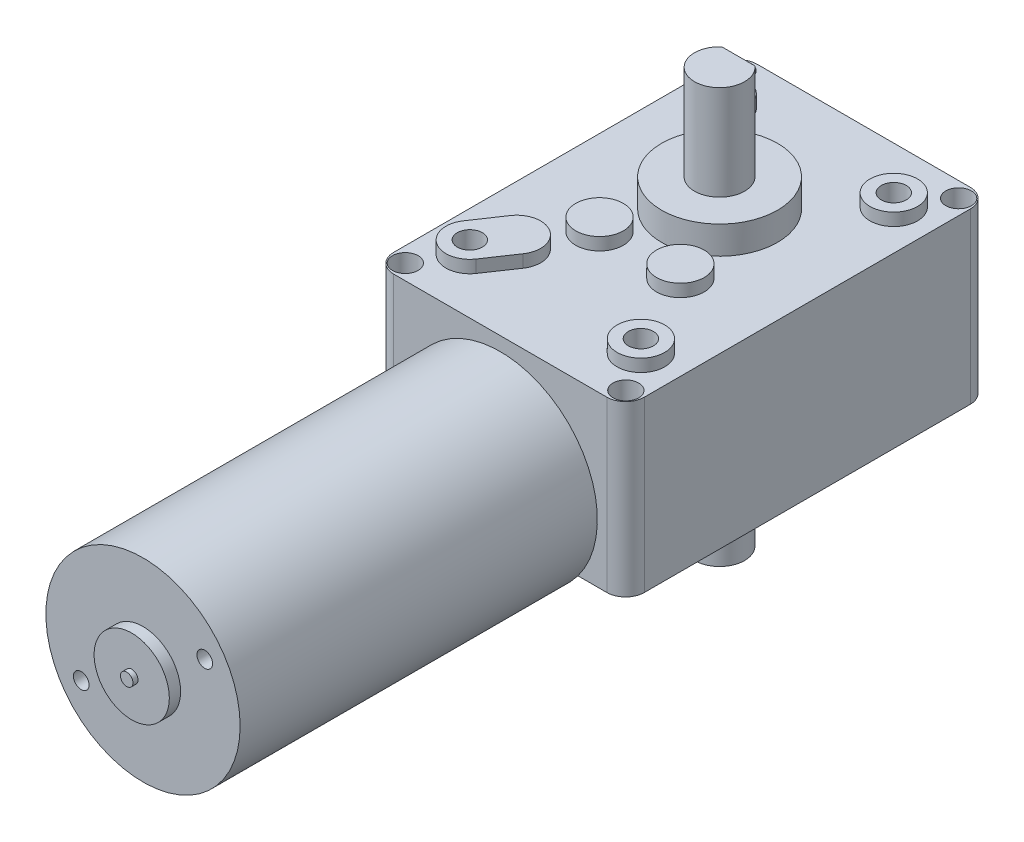
from build123d import *

# Parameters (mm, degrees)
BOSS_EXTRUDE2_DEPTH = 27
SKETCH5_R           = 3.8
BOSS_EXTRUDE3_DEPTH = 2
SKETCH6_R           = 2
CUT_EXTRUDE3_DEPTH  = 4
SKETCH7_R           = 9.25
BOSS_EXTRUDE4_DEPTH = 4.45
SKETCH8_R           = 4
BOSS_EXTRUDE5_DEPTH = 15.14
CUT_EXTRUDE4_START  = -13
CUT_EXTRUDE4_DEPTH  = 13
SKETCH11_R          = 15.5
BOSS_EXTRUDE6_DEPTH = 57
SKETCH12_R          = 6
BOSS_EXTRUDE7_DEPTH = 1.8
SKETCH13_R          = 1
BOSS_EXTRUDE8_DEPTH = 0.8
SKETCH14_R          = 1.25
CUT_EXTRUDE6_DEPTH  = 4
SKETCH10_R          = 2.05
CUT_EXTRUDE5_DEPTH  = 4


with BuildPart() as part:
    # Sketch1 → Boss-Extrude2 (new body)
    with BuildSketch(Plane(origin=(0, 0, 0), x_dir=(1, 0, 0), z_dir=(0, 1, 0))):
        with BuildLine():
            Line((17.005, -29), (-17.005, -29))
            ThreePointArc((-17.005, -29), (-19.126320344, -28.121320344), (-20.005, -26))
            Line((-20.005, -26), (-20.005, 26))
            ThreePointArc((-20.005, 26), (-19.126320344, 28.121320344), (-17.005, 29))
            Line((-17.005, 29), (17.005, 29))
            ThreePointArc((17.005, 29), (19.126320344, 28.121320344), (20.005, 26))
            Line((20.005, 26), (20.005, -26))
            ThreePointArc((20.005, -26), (19.126320344, -28.121320344), (17.005, -29))
        make_face()
    extrude(amount=BOSS_EXTRUDE2_DEPTH)

    # Sketch5 → Boss-Extrude3 (add)
    with BuildSketch(Plane(origin=(0, 27, 0), x_dir=(1, 0, 0), z_dir=(0, 1, 0))):
        with Locations(Location((-13.65, 20.15, 0), (0, 0, 90))):
            Circle(SKETCH5_R)
        with Locations(Location((13.65, 20.15, 0), (0, 0, 90))):
            Circle(SKETCH5_R)
        with Locations(Location((13.65, -20.2, 0), (0, 0, 90))):
            Circle(SKETCH5_R)
        with Locations(Location((-6.45, -6.7, 0), (0, 0, 90))):
            Circle(SKETCH5_R)
        with Locations(Location((6.45, -6.7, 0), (0, 0, 90))):
            Circle(SKETCH5_R)
        with BuildLine():
            Line((-16.798540367, -18.072397227), (-13.775104848, -13.598155653))
            ThreePointArc((-13.775104848, -13.598155653), (-8.498961708, -12.577218059), (-7.478024114, -17.853361199))
            Line((-7.478024114, -17.853361199), (-10.501459633, -22.327602773))
            ThreePointArc((-10.501459633, -22.327602773), (-15.777602773, -23.348540367), (-16.798540367, -18.072397227))
        make_face()
    boss_extrude3 = extrude(amount=BOSS_EXTRUDE3_DEPTH)

    # Sketch6 → Cut-Extrude3 (cut)
    with BuildSketch(Plane(origin=(0, 29, 0), x_dir=(1, 0, 0), z_dir=(0, 1, 0))):
        with Locations(Location((13.65, -20.2, 0), (0, 0, 270))):
            Circle(SKETCH6_R)
        with Locations(Location((13.65, 20.15, 0), (0, 0, 270))):
            Circle(SKETCH6_R)
        with Locations(Location((-13.65, 20.15, 0), (0, 0, 270))):
            Circle(SKETCH6_R)
        with Locations(Location((-13.65, -20.2, 0), (0, 0, 270))):
            Circle(SKETCH6_R)
    cut_extrude3 = extrude(amount=-CUT_EXTRUDE3_DEPTH, mode=Mode.SUBTRACT)

    # Sketch7 → Boss-Extrude4 (add)
    with BuildSketch(Plane(origin=(0, 27, 0), x_dir=(1, 0, 0), z_dir=(0, 1, 0))):
        with Locations(Location((0, 6, 0), (0, 0, 90))):
            Circle(SKETCH7_R)
    boss_extrude4 = extrude(amount=BOSS_EXTRUDE4_DEPTH)

    # Sketch8 → Boss-Extrude5 (add)
    with BuildSketch(Plane(origin=(0, 31.45, 0), x_dir=(1, 0, 0), z_dir=(0, 1, 0))):
        with Locations(Location((0, 6, 0), (0, 0, 270))):
            Circle(SKETCH8_R)
    boss_extrude5 = extrude(amount=BOSS_EXTRUDE5_DEPTH)

    # Sketch9 → Cut-Extrude4 (cut)
    with BuildSketch(Plane(origin=(0, 46.59, 0), x_dir=(1, 0, 0), z_dir=(0, 1, 0)).offset(CUT_EXTRUDE4_START)):
        with BuildLine():
            Line((-2.645751311, 9), (2.645751311, 9))
            ThreePointArc((2.645751311, 9), (0, 10), (-2.645751311, 9))
        make_face()
    cut_extrude4 = extrude(amount=CUT_EXTRUDE4_DEPTH, mode=Mode.SUBTRACT)

    # Mirror1: Boss-Extrude3, Cut-Extrude3, Boss-Extrude4, Boss-Extrude5, Cut-Extrude4 across plane
    add(boss_extrude3.mirror(Plane.ZX.offset(13.5)))
    add(cut_extrude3.mirror(Plane.ZX.offset(13.5)), mode=Mode.SUBTRACT)
    add(boss_extrude4.mirror(Plane.ZX.offset(13.5)))
    add(boss_extrude5.mirror(Plane.ZX.offset(13.5)))
    add(cut_extrude4.mirror(Plane.ZX.offset(13.5)), mode=Mode.SUBTRACT)

    # Sketch11 → Boss-Extrude6 (add)
    with BuildSketch(Plane.XY.offset(29)):
        with Locations(Location((0, 9.3, 0), (0, 0, 216.869897646))):
            Circle(SKETCH11_R)
    extrude(amount=BOSS_EXTRUDE6_DEPTH)

    # Sketch12 → Boss-Extrude7 (add)
    with BuildSketch(Plane.XY.offset(86)):
        with Locations((0, 9.3)):
            Circle(SKETCH12_R)
    extrude(amount=BOSS_EXTRUDE7_DEPTH)

    # Sketch13 → Boss-Extrude8 (add)
    with BuildSketch(Plane.XY.offset(87.8)):
        with Locations((0, 9.3)):
            Circle(SKETCH13_R)
    extrude(amount=BOSS_EXTRUDE8_DEPTH)

    # Sketch14 → Cut-Extrude6 (cut)
    with BuildSketch(Plane.XY.offset(86)):
        with Locations((9.854379173, 15.699508661)):
            Circle(SKETCH14_R)
        with Locations((-9.854379173, 2.900491339)):
            Circle(SKETCH14_R)
    extrude(amount=-CUT_EXTRUDE6_DEPTH, mode=Mode.SUBTRACT)

    # Sketch10 → Cut-Extrude5 (cut)
    with BuildSketch(Plane(origin=(0, 27, 0), x_dir=(1, 0, 0), z_dir=(0, 1, 0))):
        with Locations(Location((-17.6, 26.55, 0), (0, 0, 270))):
            Circle(SKETCH10_R)
        with Locations(Location((17.6, 26.55, 0), (0, 0, 270))):
            Circle(SKETCH10_R)
        with Locations(Location((17.6, -26.55, 0), (0, 0, 270))):
            Circle(SKETCH10_R)
        with Locations(Location((-17.6, -26.55, 0), (0, 0, 270))):
            Circle(SKETCH10_R)
    extrude(amount=-CUT_EXTRUDE5_DEPTH, mode=Mode.SUBTRACT)


solid = part.part
